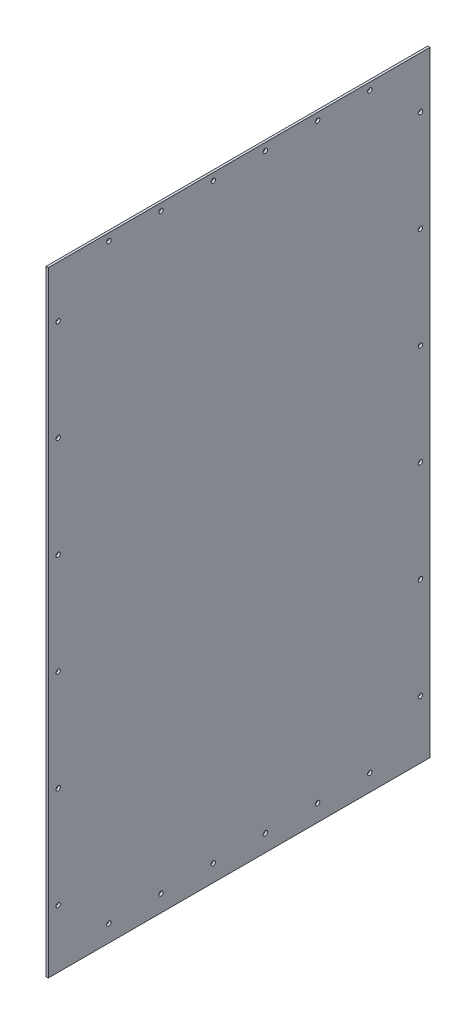
from build123d import *

# Parameters (mm, degrees)
SKETCH1_W                 = 502.3866
SKETCH1_H                 = 809.7266
SIDEPANEL_DEPTH           = 3.0734
SKETCH2_R                 = 2.8956
TOPBOTTOMHOLEMASTER_DEPTH = 477.468059202
LPATTERN1_COUNT           = 6
LPATTERN1_PITCH           = 68.690639962
SKETCH3_R                 = 2.8956
REARHOLESMASTER_DEPTH     = 477.468059202
LPATTERN2_COUNT           = 6
LPATTERN2_PITCH           = 133.13664


with BuildPart() as part:
    # Sketch1 → SidePanel (new body)
    with BuildSketch(Plane(origin=(0, 0, 0), x_dir=(0, 0, -1), z_dir=(1, 0, 0))):
        Rectangle(SKETCH1_W, SKETCH1_H)
    extrude(amount=SIDEPANEL_DEPTH)

    # Sketch2 → TopBottomHoleMaster (cut, through all)
    with BuildSketch(Plane(origin=(3.0734, 0, 0), x_dir=(0, 0, -1), z_dir=(1, 0, 0))):
        with Locations((171.9199, 395.3383)):
            Circle(SKETCH2_R)
        with Locations((171.9199, -382.6383)):
            Circle(SKETCH2_R)
    topbottomholemaster = extrude(amount=-TOPBOTTOMHOLEMASTER_DEPTH, mode=Mode.SUBTRACT)

    # LPattern1: TopBottomHoleMaster ×6
    with Locations(*[(0, 0, i * LPATTERN1_PITCH) for i in range(1, LPATTERN1_COUNT)]):
        add(topbottomholemaster, mode=Mode.SUBTRACT)

    # Sketch3 → RearHolesMaster (cut, through all)
    with BuildSketch(Plane(origin=(3.0734, 0, 0), x_dir=(0, 0, -1), z_dir=(1, 0, 0))):
        with Locations((-238.208299808, 337.4517)):
            Circle(SKETCH3_R)
        with Locations((238.5949, 337.4517)):
            Circle(SKETCH3_R)
    rearholesmaster = extrude(amount=-REARHOLESMASTER_DEPTH, mode=Mode.SUBTRACT)

    # LPattern2: RearHolesMaster ×6
    with Locations(*[(0, -i * LPATTERN2_PITCH, 0) for i in range(1, LPATTERN2_COUNT)]):
        add(rearholesmaster, mode=Mode.SUBTRACT)


solid = part.part
